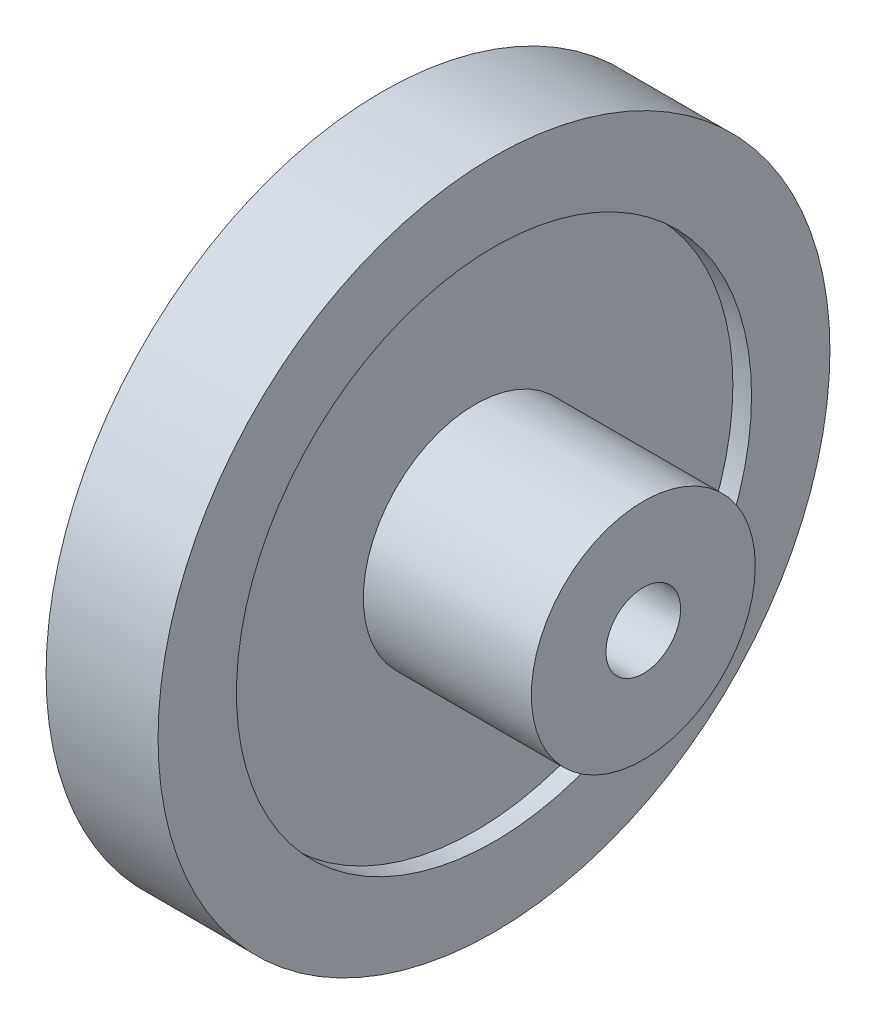
from build123d import *

# Parameters (mm, degrees)
ESQUISSE2_R             = 1
BOSS_EXTRU_1_DEPTH      = 3
ESQUISSE3_R             = 6.9
ENL_V_MAT_EXTRU_1_DEPTH = 0.5
ESQUISSE4_R             = 1
BOSS_EXTRU_2_DEPTH      = 4.5
BOSS_EXTRU_5_START      = -3
ESQUISSE7_R             = 9
ESQUISSE7_R_2           = 6.9
BOSS_EXTRU_5_DEPTH      = 3
BOSS_EXTRU_6_START      = -4.5
ESQUISSE8_R             = 3
ESQUISSE8_R_2           = 1
BOSS_EXTRU_6_DEPTH      = 4.5


with BuildPart() as part:
    # Esquisse2 → Boss.-Extru.1 (new body)
    with BuildSketch(Plane(origin=(0, 0, 0), x_dir=(0, 0, -1), z_dir=(1, 0, 0))):
        with BuildLine():
            ThreePointArc((8.992678526, 0.362950305), (8.983203595, 0.549593642), (8.969855294, 0.736000007))
            add(Edge.make_bspline(
                [(7.928017131, 0.973718567), (7.968735547, 0.978720051), (8.14599471, 0.972060465), (8.43210917, 0.923262044), (8.735368899, 0.829543111), (8.90576586, 0.762906571), (8.969855294, 0.736000007)],
                knots=[0, 0, 0, 0, 0.124841327, 0.52877899, 0.867841808, 1.076016146, 1.076016146, 1.076016146, 1.076016146], degree=3))
            ThreePointArc((7.928017131, 0.973718567), (7.845145349, 0.995861242), (7.801971612, 1.069983161))
            ThreePointArc((7.801971612, 1.069983161), (7.782401197, 1.204099918), (7.760525474, 1.337859996))
            ThreePointArc((7.760525474, 1.337859996), (7.7791127, 1.421320515), (7.851006147, 1.467607399))
            add(Edge.make_bspline(
                [(7.851006147, 1.467607399), (7.891911369, 1.47525391), (8.058869705, 1.535171146), (8.316858832, 1.668153777), (8.577616241, 1.849137964), (8.719907754, 1.964153953), (8.772869142, 2.009170729)],
                knots=[0, 0, 0, 0, 0.124841327, 0.52877899, 0.867841808, 1.076016146, 1.076016146, 1.076016146, 1.076016146], degree=3))
            ThreePointArc((8.772869142, 2.009170729), (8.729259916, 2.190895095), (8.681886815, 2.371674793))
            add(Edge.make_bspline(
                [(7.614107256, 2.413908484), (7.653213344, 2.426306797), (7.828678029, 2.452331888), (8.118887532, 2.456937748), (8.434204497, 2.420538386), (8.613944558, 2.38634682), (8.681886815, 2.371674793)],
                knots=[0, 0, 0, 0, 0.124841327, 0.52877899, 0.867841808, 1.076016146, 1.076016146, 1.076016146, 1.076016146], degree=3))
            ThreePointArc((7.614107256, 2.413908484), (7.528577818, 2.420446487), (7.472519329, 2.485373186))
            ThreePointArc((7.472519329, 2.485373186), (7.428638248, 2.613610296), (7.382556651, 2.741073201))
            ThreePointArc((7.382556651, 2.741073201), (7.385491564, 2.82652804), (7.447655696, 2.885237188))
            add(Edge.make_bspline(
                [(7.447655696, 2.885237188), (7.486459386, 2.900269817), (7.639565176, 2.989845363), (7.868726054, 3.167969089), (8.091787815, 3.393785724), (8.210522412, 3.532989345), (8.254310221, 3.586971254)],
                knots=[0, 0, 0, 0, 0.124841327, 0.52877899, 0.867841808, 1.076016146, 1.076016146, 1.076016146, 1.076016146], degree=3))
            ThreePointArc((8.254310221, 3.586971254), (8.17805176, 3.757588243), (8.098267094, 3.926585039))
            add(Edge.make_bspline(
                [(7.040908091, 3.771895641), (7.077070139, 3.791268575), (7.244765106, 3.849092091), (7.529186917, 3.906945383), (7.845823377, 3.92910513), (8.028785705, 3.928522889), (8.098267094, 3.926585039)],
                knots=[0, 0, 0, 0, 0.124841327, 0.52877899, 0.867841808, 1.076016146, 1.076016146, 1.076016146, 1.076016146], degree=3))
            ThreePointArc((7.040908091, 3.771895641), (6.955633599, 3.76260633), (6.888599363, 3.816126808))
            ThreePointArc((6.888599363, 3.816126808), (6.821901934, 3.93411731), (6.753183716, 4.050942446))
            ThreePointArc((6.753183716, 4.050942446), (6.740366371, 4.135481543), (6.790684263, 4.204613685))
            add(Edge.make_bspline(
                [(6.790684263, 4.204613685), (6.826065008, 4.226520515), (6.960104418, 4.342703981), (7.152633247, 4.559903013), (7.33040326, 4.822862182), (7.421537577, 4.981513022), (7.454660665, 5.042621775)],
                knots=[0, 0, 0, 0, 0.124841327, 0.52877899, 0.867841808, 1.076016146, 1.076016146, 1.076016146, 1.076016146], degree=3))
            ThreePointArc((7.454660665, 5.042621775), (7.34834986, 5.19632123), (7.2388706, 5.34778014))
            add(Edge.make_bspline(
                [(6.227939246, 5.001435417), (6.259925799, 5.027123248), (6.414140397, 5.114776078), (6.683088872, 5.223906679), (6.990262151, 5.303870911), (7.170216185, 5.336917824), (7.2388706, 5.34778014)],
                knots=[0, 0, 0, 0, 0.124841327, 0.52877899, 0.867841808, 1.076016146, 1.076016146, 1.076016146, 1.076016146], degree=3))
            ThreePointArc((6.227939246, 5.001435417), (6.14582362, 4.976635127), (6.070096408, 5.016926809))
            ThreePointArc((6.070096408, 5.016926809), (5.982853931, 5.120652678), (5.893839209, 5.222861704))
            ThreePointArc((5.893839209, 5.222861704), (5.865706085, 5.303606182), (5.902464222, 5.380807106))
            add(Edge.make_bspline(
                [(5.902464222, 5.380807106), (5.933217173, 5.408842125), (6.043625651, 5.547677024), (6.192966094, 5.79655491), (6.319390614, 6.087701853), (6.379821181, 6.260397247), (6.401151581, 6.32655186)],
                knots=[0, 0, 0, 0, 0.124841327, 0.52877899, 0.867841808, 1.076016146, 1.076016146, 1.076016146, 1.076016146], degree=3))
            ThreePointArc((6.401151581, 6.32655186), (6.268408719, 6.45809973), (6.13296305, 6.586863003))
            add(Edge.make_bspline(
                [(5.202885399, 6.060657308), (5.229607193, 6.091785269), (5.36508983, 6.206282501), (5.60940625, 6.362974098), (5.896655932, 6.498019729), (6.067473552, 6.563570423), (6.13296305, 6.586863003)],
                knots=[0, 0, 0, 0, 0.124841327, 0.52877899, 0.867841808, 1.076016146, 1.076016146, 1.076016146, 1.076016146], degree=3))
            ThreePointArc((5.202885399, 6.060657308), (5.126724989, 6.021190583), (5.044883599, 6.046881384))
            ThreePointArc((5.044883599, 6.046881384), (4.940067013, 6.13281036), (4.833787077, 6.216922671))
            ThreePointArc((4.833787077, 6.216922671), (4.791296214, 6.291122873), (4.813242841, 6.373763594))
            add(Edge.make_bspline(
                [(4.813242841, 6.373763594), (4.838320743, 6.406972104), (4.921338461, 6.563730579), (5.022404908, 6.835812081), (5.0931787, 7.145232139), (5.120847626, 7.326091153), (5.129658958, 7.395038808)],
                knots=[0, 0, 0, 0, 0.124841327, 0.52877899, 0.867841808, 1.076016146, 1.076016146, 1.076016146, 1.076016146], degree=3))
            ThreePointArc((5.129658958, 7.395038808), (4.975004437, 7.49995539), (4.818204799, 7.601638147))
            add(Edge.make_bspline(
                [(4.00065353, 6.913490784), (4.021200587, 6.948998848), (4.133337563, 7.086441417), (4.344702027, 7.285358066), (4.602246167, 7.470886279), (4.758110384, 7.566708503), (4.818204799, 7.601638147)],
                knots=[0, 0, 0, 0, 0.124841327, 0.52877899, 0.867841808, 1.076016146, 1.076016146, 1.076016146, 1.076016146], degree=3))
            ThreePointArc((4.00065353, 6.913490784), (3.933041887, 6.860701616), (3.84787333, 6.870916666))
            ThreePointArc((3.84787333, 6.870916666), (3.729052038, 6.936122541), (3.609126123, 6.999273793))
            ThreePointArc((3.609126123, 6.999273793), (3.553724497, 7.06440292), (3.560112248, 7.149669208))
            add(Edge.make_bspline(
                [(3.560112248, 7.149669208), (3.578661103, 7.186920332), (3.631460993, 7.356264162), (3.680811746, 7.64228387), (3.693524693, 7.959440113), (3.687489747, 8.142303811), (3.683481951, 8.21169658)],
                knots=[0, 0, 0, 0, 0.124841327, 0.52877899, 0.867841808, 1.076016146, 1.076016146, 1.076016146, 1.076016146], degree=3))
            ThreePointArc((3.683481951, 8.21169658), (3.512182346, 8.286409063), (3.339368362, 8.35754862))
            add(Edge.make_bspline(
                [(2.662184203, 7.530893622), (2.675856818, 7.569572607), (2.760829443, 7.72528007), (2.932044187, 7.959647903), (3.151112429, 8.189340757), (3.286715474, 8.3121714), (3.339368362, 8.35754862)],
                knots=[0, 0, 0, 0, 0.124841327, 0.52877899, 0.867841808, 1.076016146, 1.076016146, 1.076016146, 1.076016146], degree=3))
            ThreePointArc((2.662184203, 7.530893622), (2.605423761, 7.466579684), (2.51982835, 7.460971122))
            ThreePointArc((2.51982835, 7.460971122), (2.391048668, 7.503233388), (2.261560708, 7.543273041))
            ThreePointArc((2.261560708, 7.543273041), (2.195134954, 7.597113198), (2.185746302, 7.682101412))
            add(Edge.make_bspline(
                [(2.185746302, 7.682101412), (2.197134452, 7.722126608), (2.217918476, 7.898288992), (2.213872956, 8.188506848), (2.168092134, 8.502598901), (2.128558827, 8.681240079), (2.111868384, 8.748714873)],
                knots=[0, 0, 0, 0, 0.124841327, 0.52877899, 0.867841808, 1.076016146, 1.076016146, 1.076016146, 1.076016146], degree=3))
            ThreePointArc((2.111868384, 8.748714873), (1.929757098, 8.790679015), (1.74681374, 8.8288528))
            add(Edge.make_bspline(
                [(1.233057386, 7.891840911), (1.239389954, 7.932373648), (1.294304588, 8.101043575), (1.419539098, 8.362881478), (1.592671336, 8.628917058), (1.70339541, 8.77457327), (1.74681374, 8.8288528)],
                knots=[0, 0, 0, 0, 0.124841327, 0.52877899, 0.867841808, 1.076016146, 1.076016146, 1.076016146, 1.076016146], degree=3))
            ThreePointArc((1.233057386, 7.891840911), (1.189081054, 7.818192336), (1.105973638, 7.796951155))
            ThreePointArc((1.105973638, 7.796951155), (0.971621004, 7.81483062), (0.836980555, 7.830395172))
            ThreePointArc((0.836980555, 7.830395172), (0.761792723, 7.871112898), (0.736947387, 7.952928866))
            add(Edge.make_bspline(
                [(0.736947387, 7.952928866), (0.740787022, 7.994365125), (0.728847405, 8.171347063), (0.671543377, 8.455880046), (0.568827797, 8.756211882), (0.49714239, 8.924547128), (0.468337672, 8.987806174)],
                knots=[0, 0, 0, 0, 0.124841327, 0.52877899, 0.867841808, 1.076016146, 1.076016146, 1.076016146, 1.076016146], degree=3))
            ThreePointArc((0.468337672, 8.987806174), (0.281616286, 8.995592936), (0.094773472, 8.999500986))
            add(Edge.make_bspline(
                [(-0.238059721, 7.984041022), (-0.239282848, 8.02504722), (-0.216296258, 8.200935757), (-0.141306691, 8.481327153), (-0.020006268, 8.774645937), (0.062068259, 8.938167571), (0.094773472, 8.999500986)],
                knots=[0, 0, 0, 0, 0.124841327, 0.52877899, 0.867841808, 1.076016146, 1.076016146, 1.076016146, 1.076016146], degree=3))
            ThreePointArc((-0.238059721, 7.984041022), (-0.267754383, 7.903565825), (-0.34554368, 7.867415368))
            ThreePointArc((-0.34554368, 7.867415368), (-0.480894049, 7.860303169), (-0.616101967, 7.850862587))
            ThreePointArc((-0.616101967, 7.850862587), (-0.697491446, 7.877071289), (-0.736947387, 7.952928866))
            add(Edge.make_bspline(
                [(-0.736947387, 7.952928866), (-0.740787022, 7.994365125), (-0.78504369, 8.166139711), (-0.893654807, 8.435298391), (-1.049807289, 8.711642568), (-1.151203635, 8.863939428), (-1.191141718, 8.920828516)],
                knots=[0, 0, 0, 0, 0.124841327, 0.52877899, 0.867841808, 1.076016146, 1.076016146, 1.076016146, 1.076016146], degree=3))
            ThreePointArc((-1.191141718, 8.920828516), (-1.376114631, 8.894172728), (-1.560494193, 8.863681959))
            add(Edge.make_bspline(
                [(-1.70106999, 7.804354193), (-1.70980716, 7.844437433), (-1.719531394, 8.021554909), (-1.697340451, 8.310951405), (-1.632002584, 8.621564774), (-1.581372552, 8.797383295), (-1.560494193, 8.863681959)],
                knots=[0, 0, 0, 0, 0.124841327, 0.52877899, 0.867841808, 1.076016146, 1.076016146, 1.076016146, 1.076016146], degree=3))
            ThreePointArc((-1.70106999, 7.804354193), (-1.715471765, 7.719792859), (-1.785293922, 7.669964186))
            ThreePointArc((-1.785293922, 7.669964186), (-1.917032831, 7.638102521), (-2.048203875, 7.603978293))
            ThreePointArc((-2.048203875, 7.603978293), (-2.13302338, 7.614785465), (-2.185746302, 7.682101412))
            add(Edge.make_bspline(
                [(-2.185746302, 7.682101412), (-2.197134452, 7.722126608), (-2.272201064, 7.882844264), (-2.428420647, 8.127462766), (-2.632692446, 8.370408715), (-2.760346802, 8.501480902), (-2.810058205, 8.550062742)],
                knots=[0, 0, 0, 0, 0.124841327, 0.52877899, 0.867841808, 1.076016146, 1.076016146, 1.076016146, 1.076016146], degree=3))
            ThreePointArc((-2.810058205, 8.550062742), (-2.986983615, 8.489872136), (-3.1626211, 8.426020875))
            add(Edge.make_bspline(
                [(-3.106152361, 7.358899441), (-3.12210604, 7.396694737), (-3.164209951, 7.569009628), (-3.195573318, 7.857556174), (-3.188423008, 8.174886562), (-3.170961618, 8.357014683), (-3.1626211, 8.426020875)],
                knots=[0, 0, 0, 0, 0.124841327, 0.52877899, 0.867841808, 1.076016146, 1.076016146, 1.076016146, 1.076016146], degree=3))
            ThreePointArc((-3.106152361, 7.358899441), (-3.104770813, 7.273131606), (-3.164248122, 7.211321573))
            ThreePointArc((-3.164248122, 7.211321573), (-3.287889359, 7.155795453), (-3.410556657, 7.098149639))
            ThreePointArc((-3.410556657, 7.098149639), (-3.49591776, 7.093187254), (-3.560112248, 7.149669208))
            add(Edge.make_bspline(
                [(-3.560112248, 7.149669208), (-3.578661103, 7.186920332), (-3.681981355, 7.331108011), (-3.880489536, 7.542856145), (-4.125924419, 7.744130633), (-4.275489668, 7.84951464), (-4.33328153, 7.888134836)],
                knots=[0, 0, 0, 0, 0.124841327, 0.52877899, 0.867841808, 1.076016146, 1.076016146, 1.076016146, 1.076016146], degree=3))
            ThreePointArc((-4.33328153, 7.888134836), (-4.496134454, 7.79645913), (-4.657048739, 7.701421755))
            add(Edge.make_bspline(
                [(-4.405458438, 6.662846196), (-4.428085343, 6.697066474), (-4.501135134, 6.858710803), (-4.584984768, 7.136581292), (-4.636265512, 7.449822393), (-4.652567389, 7.632057959), (-4.657048739, 7.701421755)],
                knots=[0, 0, 0, 0, 0.124841327, 0.52877899, 0.867841808, 1.076016146, 1.076016146, 1.076016146, 1.076016146], degree=3))
            ThreePointArc((-4.405458438, 6.662846196), (-4.388340616, 6.578792579), (-4.435447646, 6.507106053))
            ThreePointArc((-4.435447646, 6.507106053), (-4.546780759, 6.429806352), (-4.656767022, 6.350602011))
            ThreePointArc((-4.656767022, 6.350602011), (-4.739762855, 6.330039059), (-4.813242841, 6.373763594))
            add(Edge.make_bspline(
                [(-4.813242841, 6.373763594), (-4.838320743, 6.406972104), (-4.966376188, 6.529719667), (-5.200413007, 6.701386604), (-5.478652985, 6.85413547), (-5.645035862, 6.930242572), (-5.70894015, 6.957585958)],
                knots=[0, 0, 0, 0, 0.124841327, 0.52877899, 0.867841808, 1.076016146, 1.076016146, 1.076016146, 1.076016146], degree=3))
            ThreePointArc((-5.70894015, 6.957585958), (-5.852174827, 6.83754706), (-5.992886168, 6.714559954))
            add(Edge.make_bspline(
                [(-5.554741912, 5.739897714), (-5.58327151, 5.769377644), (-5.684779557, 5.914846807), (-5.81826006, 6.172578694), (-5.926225553, 6.471063457), (-5.975735558, 6.647200654), (-5.992886168, 6.714559954)],
                knots=[0, 0, 0, 0, 0.124841327, 0.52877899, 0.867841808, 1.076016146, 1.076016146, 1.076016146, 1.076016146], degree=3))
            ThreePointArc((-5.554741912, 5.739897714), (-5.522470742, 5.660420661), (-5.555603321, 5.58129884))
            ThreePointArc((-5.555603321, 5.58129884), (-5.650836993, 5.484857908), (-5.744396771, 5.386792249))
            ThreePointArc((-5.744396771, 5.386792249), (-5.82220101, 5.351328976), (-5.902464222, 5.380807106))
            add(Edge.make_bspline(
                [(-5.902464222, 5.380807106), (-5.933217173, 5.408842125), (-6.081647036, 5.505969552), (-6.34324265, 5.63170938), (-6.644812595, 5.730730945), (-6.82234713, 5.774969405), (-6.89018766, 5.790104836)],
                knots=[0, 0, 0, 0, 0.124841327, 0.52877899, 0.867841808, 1.076016146, 1.076016146, 1.076016146, 1.076016146], degree=3))
            ThreePointArc((-6.89018766, 5.790104836), (-7.008926405, 5.645790525), (-7.124643046, 5.499041868))
            add(Edge.make_bspline(
                [(-6.514865313, 4.6214839), (-6.548326063, 4.645219578), (-6.674835631, 4.769559798), (-6.853401485, 4.998376331), (-7.014375092, 5.271940217), (-7.095407219, 5.435980904), (-7.124643046, 5.499041868)],
                knots=[0, 0, 0, 0, 0.124841327, 0.52877899, 0.867841808, 1.076016146, 1.076016146, 1.076016146, 1.076016146], degree=3))
            ThreePointArc((-6.514865313, 4.6214839), (-6.46853975, 4.549289907), (-6.486569587, 4.46542719))
            ThreePointArc((-6.486569587, 4.46542719), (-6.562460751, 4.353129207), (-6.636407979, 4.239541737))
            ThreePointArc((-6.636407979, 4.239541737), (-6.706371093, 4.190385802), (-6.790684263, 4.204613685))
            add(Edge.make_bspline(
                [(-6.790684263, 4.204613685), (-6.826065008, 4.226520515), (-6.989814688, 4.294720246), (-7.270060773, 4.370251048), (-7.584691081, 4.41217325), (-7.767331549, 4.423036581), (-7.836798093, 4.425448638)],
                knots=[0, 0, 0, 0, 0.124841327, 0.52877899, 0.867841808, 1.076016146, 1.076016146, 1.076016146, 1.076016146], degree=3))
            ThreePointArc((-7.836798093, 4.425448638), (-7.9269974, 4.261773366), (-8.013778751, 4.096260505))
            add(Edge.make_bspline(
                [(-7.253132789, 3.345690994), (-7.290385226, 3.362874131), (-7.437588183, 3.46185115), (-7.655158542, 3.653960257), (-7.863658499, 3.893287376), (-7.973453297, 4.039645344), (-8.013778751, 4.096260505)],
                knots=[0, 0, 0, 0, 0.124841327, 0.52877899, 0.867841808, 1.076016146, 1.076016146, 1.076016146, 1.076016146], degree=3))
            ThreePointArc((-7.253132789, 3.345690994), (-7.194330395, 3.283238541), (-7.196643507, 3.197490772))
            ThreePointArc((-7.196643507, 3.197490772), (-7.250607779, 3.073159911), (-7.302424271, 2.947918717))
            ThreePointArc((-7.302424271, 2.947918717), (-7.362163751, 2.886744066), (-7.447655696, 2.885237188))
            add(Edge.make_bspline(
                [(-7.447655696, 2.885237188), (-7.486459386, 2.900269817), (-7.659952585, 2.937219394), (-7.949305695, 2.959969057), (-8.266282009, 2.943364287), (-8.447808808, 2.920482551), (-8.516535767, 2.910089094)],
                knots=[0, 0, 0, 0, 0.124841327, 0.52877899, 0.867841808, 1.076016146, 1.076016146, 1.076016146, 1.076016146], degree=3))
            ThreePointArc((-8.516535767, 2.910089094), (-8.575124006, 2.732626625), (-8.630014832, 2.553985905))
            add(Edge.make_bspline(
                [(-7.744403527, 1.955964595), (-7.784179063, 1.966010038), (-7.94706259, 2.036253313), (-8.196228356, 2.185112949), (-8.445154448, 2.382053302), (-8.579972987, 2.505744507), (-8.630014832, 2.553985905)],
                knots=[0, 0, 0, 0, 0.124841327, 0.52877899, 0.867841808, 1.076016146, 1.076016146, 1.076016146, 1.076016146], degree=3))
            ThreePointArc((-7.744403527, 1.955964595), (-7.675126748, 1.905380425), (-7.661644363, 1.820667641))
            ThreePointArc((-7.661644363, 1.820667641), (-7.691844055, 1.68853784), (-7.719765264, 1.55590786))
            ThreePointArc((-7.719765264, 1.55590786), (-7.767246753, 1.484797724), (-7.851006147, 1.467607399))
            add(Edge.make_bspline(
                [(-7.851006147, 1.467607399), (-7.891911369, 1.47525391), (-8.069239983, 1.479695059), (-8.357846547, 1.448888871), (-8.666374618, 1.374322583), (-8.84060607, 1.318474991), (-8.906253029, 1.295629957)],
                knots=[0, 0, 0, 0, 0.124841327, 0.52877899, 0.867841808, 1.076016146, 1.076016146, 1.076016146, 1.076016146], degree=3))
            ThreePointArc((-8.906253029, 1.295629957), (-8.93123505, 1.110423563), (-8.952366108, 0.924738377))
            add(Edge.make_bspline(
                [(-7.971947891, 0.499630167), (-8.012892019, 0.502195832), (-8.185909312, 0.541313312), (-8.458185443, 0.641854241), (-8.73906079, 0.78970126), (-8.894311987, 0.886513545), (-8.952366108, 0.924738377)],
                knots=[0, 0, 0, 0, 0.124841327, 0.52877899, 0.867841808, 1.076016146, 1.076016146, 1.076016146, 1.076016146], degree=3))
            ThreePointArc((-7.971947891, 0.499630167), (-7.894555864, 0.462636863), (-7.865737109, 0.381843858))
            ThreePointArc((-7.865737109, 0.381843858), (-7.871143807, 0.246414639), (-7.874218909, 0.110912427))
            ThreePointArc((-7.874218909, 0.110912427), (-7.907825483, 0.032288375), (-7.987, 0))
            add(Edge.make_bspline(
                [(-7.987, 0), (-8.028613776, 0), (-8.203739092, -0.028218518), (-8.481770958, -0.111531489), (-8.771344233, -0.241520028), (-8.932347096, -0.328431654), (-8.992678526, -0.362950305)],
                knots=[0, 0, 0, 0, 0.124841327, 0.52877899, 0.867841808, 1.076016146, 1.076016146, 1.076016146, 1.076016146], degree=3))
            ThreePointArc((-8.992678526, -0.362950305), (-8.983203595, -0.549593642), (-8.969855294, -0.736000007))
            add(Edge.make_bspline(
                [(-7.928017131, -0.973718567), (-7.968735547, -0.978720051), (-8.14599471, -0.972060465), (-8.43210917, -0.923262044), (-8.735368899, -0.829543111), (-8.90576586, -0.762906571), (-8.969855294, -0.736000007)],
                knots=[0, 0, 0, 0, 0.124841327, 0.52877899, 0.867841808, 1.076016146, 1.076016146, 1.076016146, 1.076016146], degree=3))
            ThreePointArc((-7.928017131, -0.973718567), (-7.845145349, -0.995861242), (-7.801971612, -1.069983161))
            ThreePointArc((-7.801971612, -1.069983161), (-7.782401197, -1.204099918), (-7.760525474, -1.337859996))
            ThreePointArc((-7.760525474, -1.337859996), (-7.7791127, -1.421320515), (-7.851006147, -1.467607399))
            add(Edge.make_bspline(
                [(-7.851006147, -1.467607399), (-7.891911369, -1.47525391), (-8.058869705, -1.535171146), (-8.316858832, -1.668153777), (-8.577616241, -1.849137964), (-8.719907754, -1.964153953), (-8.772869142, -2.009170729)],
                knots=[0, 0, 0, 0, 0.124841327, 0.52877899, 0.867841808, 1.076016146, 1.076016146, 1.076016146, 1.076016146], degree=3))
            ThreePointArc((-8.772869142, -2.009170729), (-8.729259916, -2.190895095), (-8.681886815, -2.371674793))
            add(Edge.make_bspline(
                [(-7.614107256, -2.413908484), (-7.653213344, -2.426306797), (-7.828678029, -2.452331888), (-8.118887532, -2.456937748), (-8.434204497, -2.420538386), (-8.613944558, -2.38634682), (-8.681886815, -2.371674793)],
                knots=[0, 0, 0, 0, 0.124841327, 0.52877899, 0.867841808, 1.076016146, 1.076016146, 1.076016146, 1.076016146], degree=3))
            ThreePointArc((-7.614107256, -2.413908484), (-7.528577818, -2.420446487), (-7.472519329, -2.485373186))
            ThreePointArc((-7.472519329, -2.485373186), (-7.428638248, -2.613610296), (-7.382556651, -2.741073201))
            ThreePointArc((-7.382556651, -2.741073201), (-7.385491564, -2.82652804), (-7.447655696, -2.885237188))
            add(Edge.make_bspline(
                [(-7.447655696, -2.885237188), (-7.486459386, -2.900269817), (-7.639565176, -2.989845363), (-7.868726054, -3.167969089), (-8.091787815, -3.393785724), (-8.210522412, -3.532989345), (-8.254310221, -3.586971254)],
                knots=[0, 0, 0, 0, 0.124841327, 0.52877899, 0.867841808, 1.076016146, 1.076016146, 1.076016146, 1.076016146], degree=3))
            ThreePointArc((-8.254310221, -3.586971254), (-8.17805176, -3.757588243), (-8.098267094, -3.926585039))
            add(Edge.make_bspline(
                [(-7.040908091, -3.771895641), (-7.077070139, -3.791268575), (-7.244765106, -3.849092091), (-7.529186917, -3.906945383), (-7.845823377, -3.92910513), (-8.028785705, -3.928522889), (-8.098267094, -3.926585039)],
                knots=[0, 0, 0, 0, 0.124841327, 0.52877899, 0.867841808, 1.076016146, 1.076016146, 1.076016146, 1.076016146], degree=3))
            ThreePointArc((-7.040908091, -3.771895641), (-6.955633599, -3.76260633), (-6.888599363, -3.816126808))
            ThreePointArc((-6.888599363, -3.816126808), (-6.821901934, -3.93411731), (-6.753183716, -4.050942446))
            ThreePointArc((-6.753183716, -4.050942446), (-6.740366371, -4.135481543), (-6.790684263, -4.204613685))
            add(Edge.make_bspline(
                [(-6.790684263, -4.204613685), (-6.826065008, -4.226520515), (-6.960104418, -4.342703981), (-7.152633247, -4.559903013), (-7.33040326, -4.822862182), (-7.421537577, -4.981513022), (-7.454660665, -5.042621775)],
                knots=[0, 0, 0, 0, 0.124841327, 0.52877899, 0.867841808, 1.076016146, 1.076016146, 1.076016146, 1.076016146], degree=3))
            ThreePointArc((-7.454660665, -5.042621775), (-7.34834986, -5.19632123), (-7.2388706, -5.34778014))
            add(Edge.make_bspline(
                [(-6.227939246, -5.001435417), (-6.259925799, -5.027123248), (-6.414140397, -5.114776078), (-6.683088872, -5.223906679), (-6.990262151, -5.303870911), (-7.170216185, -5.336917824), (-7.2388706, -5.34778014)],
                knots=[0, 0, 0, 0, 0.124841327, 0.52877899, 0.867841808, 1.076016146, 1.076016146, 1.076016146, 1.076016146], degree=3))
            ThreePointArc((-6.227939246, -5.001435417), (-6.14582362, -4.976635127), (-6.070096408, -5.016926809))
            ThreePointArc((-6.070096408, -5.016926809), (-5.982853931, -5.120652678), (-5.893839209, -5.222861704))
            ThreePointArc((-5.893839209, -5.222861704), (-5.865706085, -5.303606182), (-5.902464222, -5.380807106))
            add(Edge.make_bspline(
                [(-5.902464222, -5.380807106), (-5.933217173, -5.408842125), (-6.043625651, -5.547677024), (-6.192966094, -5.79655491), (-6.319390614, -6.087701853), (-6.379821181, -6.260397247), (-6.401151581, -6.32655186)],
                knots=[0, 0, 0, 0, 0.124841327, 0.52877899, 0.867841808, 1.076016146, 1.076016146, 1.076016146, 1.076016146], degree=3))
            ThreePointArc((-6.401151581, -6.32655186), (-6.268408719, -6.45809973), (-6.13296305, -6.586863003))
            add(Edge.make_bspline(
                [(-5.202885399, -6.060657308), (-5.229607193, -6.091785269), (-5.36508983, -6.206282501), (-5.60940625, -6.362974098), (-5.896655932, -6.498019729), (-6.067473552, -6.563570423), (-6.13296305, -6.586863003)],
                knots=[0, 0, 0, 0, 0.124841327, 0.52877899, 0.867841808, 1.076016146, 1.076016146, 1.076016146, 1.076016146], degree=3))
            ThreePointArc((-5.202885399, -6.060657308), (-5.126724989, -6.021190583), (-5.044883599, -6.046881384))
            ThreePointArc((-5.044883599, -6.046881384), (-4.940067013, -6.13281036), (-4.833787077, -6.216922671))
            ThreePointArc((-4.833787077, -6.216922671), (-4.791296214, -6.291122873), (-4.813242841, -6.373763594))
            add(Edge.make_bspline(
                [(-4.813242841, -6.373763594), (-4.838320743, -6.406972104), (-4.921338461, -6.563730579), (-5.022404908, -6.835812081), (-5.0931787, -7.145232139), (-5.120847626, -7.326091153), (-5.129658958, -7.395038808)],
                knots=[0, 0, 0, 0, 0.124841327, 0.52877899, 0.867841808, 1.076016146, 1.076016146, 1.076016146, 1.076016146], degree=3))
            ThreePointArc((-5.129658958, -7.395038808), (-4.975004437, -7.49995539), (-4.818204799, -7.601638147))
            add(Edge.make_bspline(
                [(-4.00065353, -6.913490784), (-4.021200587, -6.948998848), (-4.133337563, -7.086441417), (-4.344702027, -7.285358066), (-4.602246167, -7.470886279), (-4.758110384, -7.566708503), (-4.818204799, -7.601638147)],
                knots=[0, 0, 0, 0, 0.124841327, 0.52877899, 0.867841808, 1.076016146, 1.076016146, 1.076016146, 1.076016146], degree=3))
            ThreePointArc((-4.00065353, -6.913490784), (-3.933041887, -6.860701616), (-3.84787333, -6.870916666))
            ThreePointArc((-3.84787333, -6.870916666), (-3.729052038, -6.936122541), (-3.609126123, -6.999273793))
            ThreePointArc((-3.609126123, -6.999273793), (-3.553724497, -7.06440292), (-3.560112248, -7.149669208))
            add(Edge.make_bspline(
                [(-3.560112248, -7.149669208), (-3.578661103, -7.186920332), (-3.631460993, -7.356264162), (-3.680811746, -7.64228387), (-3.693524693, -7.959440113), (-3.687489747, -8.142303811), (-3.683481951, -8.21169658)],
                knots=[0, 0, 0, 0, 0.124841327, 0.52877899, 0.867841808, 1.076016146, 1.076016146, 1.076016146, 1.076016146], degree=3))
            ThreePointArc((-3.683481951, -8.21169658), (-3.512182346, -8.286409063), (-3.339368362, -8.35754862))
            add(Edge.make_bspline(
                [(-2.662184203, -7.530893622), (-2.675856818, -7.569572607), (-2.760829443, -7.72528007), (-2.932044187, -7.959647903), (-3.151112429, -8.189340757), (-3.286715474, -8.3121714), (-3.339368362, -8.35754862)],
                knots=[0, 0, 0, 0, 0.124841327, 0.52877899, 0.867841808, 1.076016146, 1.076016146, 1.076016146, 1.076016146], degree=3))
            ThreePointArc((-2.662184203, -7.530893622), (-2.605423761, -7.466579684), (-2.51982835, -7.460971122))
            ThreePointArc((-2.51982835, -7.460971122), (-2.391048668, -7.503233388), (-2.261560708, -7.543273041))
            ThreePointArc((-2.261560708, -7.543273041), (-2.195134954, -7.597113198), (-2.185746302, -7.682101412))
            add(Edge.make_bspline(
                [(-2.185746302, -7.682101412), (-2.197134452, -7.722126608), (-2.217918476, -7.898288992), (-2.213872956, -8.188506848), (-2.168092134, -8.502598901), (-2.128558827, -8.681240079), (-2.111868384, -8.748714873)],
                knots=[0, 0, 0, 0, 0.124841327, 0.52877899, 0.867841808, 1.076016146, 1.076016146, 1.076016146, 1.076016146], degree=3))
            ThreePointArc((-2.111868384, -8.748714873), (-1.929757098, -8.790679015), (-1.74681374, -8.8288528))
            add(Edge.make_bspline(
                [(-1.233057386, -7.891840911), (-1.239389954, -7.932373648), (-1.294304588, -8.101043575), (-1.419539098, -8.362881478), (-1.592671336, -8.628917058), (-1.70339541, -8.77457327), (-1.74681374, -8.8288528)],
                knots=[0, 0, 0, 0, 0.124841327, 0.52877899, 0.867841808, 1.076016146, 1.076016146, 1.076016146, 1.076016146], degree=3))
            ThreePointArc((-1.233057386, -7.891840911), (-1.189081054, -7.818192336), (-1.105973638, -7.796951155))
            ThreePointArc((-1.105973638, -7.796951155), (-0.971621004, -7.81483062), (-0.836980555, -7.830395172))
            ThreePointArc((-0.836980555, -7.830395172), (-0.761792723, -7.871112898), (-0.736947387, -7.952928866))
            add(Edge.make_bspline(
                [(-0.736947387, -7.952928866), (-0.740787022, -7.994365125), (-0.728847405, -8.171347063), (-0.671543377, -8.455880046), (-0.568827797, -8.756211882), (-0.49714239, -8.924547128), (-0.468337672, -8.987806174)],
                knots=[0, 0, 0, 0, 0.124841327, 0.52877899, 0.867841808, 1.076016146, 1.076016146, 1.076016146, 1.076016146], degree=3))
            ThreePointArc((-0.468337672, -8.987806174), (-0.281616286, -8.995592936), (-0.094773472, -8.999500986))
            add(Edge.make_bspline(
                [(0.238059721, -7.984041022), (0.239282848, -8.02504722), (0.216296258, -8.200935757), (0.141306691, -8.481327153), (0.020006268, -8.774645937), (-0.062068259, -8.938167571), (-0.094773472, -8.999500986)],
                knots=[0, 0, 0, 0, 0.124841327, 0.52877899, 0.867841808, 1.076016146, 1.076016146, 1.076016146, 1.076016146], degree=3))
            ThreePointArc((0.238059721, -7.984041022), (0.267754383, -7.903565825), (0.34554368, -7.867415368))
            ThreePointArc((0.34554368, -7.867415368), (0.480894049, -7.860303169), (0.616101967, -7.850862587))
            ThreePointArc((0.616101967, -7.850862587), (0.697491446, -7.877071289), (0.736947387, -7.952928866))
            add(Edge.make_bspline(
                [(0.736947387, -7.952928866), (0.740787022, -7.994365125), (0.78504369, -8.166139711), (0.893654807, -8.435298391), (1.049807289, -8.711642568), (1.151203635, -8.863939428), (1.191141718, -8.920828516)],
                knots=[0, 0, 0, 0, 0.124841327, 0.52877899, 0.867841808, 1.076016146, 1.076016146, 1.076016146, 1.076016146], degree=3))
            ThreePointArc((1.191141718, -8.920828516), (1.376114631, -8.894172728), (1.560494193, -8.863681959))
            add(Edge.make_bspline(
                [(1.70106999, -7.804354193), (1.70980716, -7.844437433), (1.719531394, -8.021554909), (1.697340451, -8.310951405), (1.632002584, -8.621564774), (1.581372552, -8.797383295), (1.560494193, -8.863681959)],
                knots=[0, 0, 0, 0, 0.124841327, 0.52877899, 0.867841808, 1.076016146, 1.076016146, 1.076016146, 1.076016146], degree=3))
            ThreePointArc((1.70106999, -7.804354193), (1.715471765, -7.719792859), (1.785293922, -7.669964186))
            ThreePointArc((1.785293922, -7.669964186), (1.917032831, -7.638102521), (2.048203875, -7.603978293))
            ThreePointArc((2.048203875, -7.603978293), (2.13302338, -7.614785465), (2.185746302, -7.682101412))
            add(Edge.make_bspline(
                [(2.185746302, -7.682101412), (2.197134452, -7.722126608), (2.272201064, -7.882844264), (2.428420647, -8.127462766), (2.632692446, -8.370408715), (2.760346802, -8.501480902), (2.810058205, -8.550062742)],
                knots=[0, 0, 0, 0, 0.124841327, 0.52877899, 0.867841808, 1.076016146, 1.076016146, 1.076016146, 1.076016146], degree=3))
            ThreePointArc((2.810058205, -8.550062742), (2.986983615, -8.489872136), (3.1626211, -8.426020875))
            add(Edge.make_bspline(
                [(3.106152361, -7.358899441), (3.12210604, -7.396694737), (3.164209951, -7.569009628), (3.195573318, -7.857556174), (3.188423008, -8.174886562), (3.170961618, -8.357014683), (3.1626211, -8.426020875)],
                knots=[0, 0, 0, 0, 0.124841327, 0.52877899, 0.867841808, 1.076016146, 1.076016146, 1.076016146, 1.076016146], degree=3))
            ThreePointArc((3.106152361, -7.358899441), (3.104770813, -7.273131606), (3.164248122, -7.211321573))
            ThreePointArc((3.164248122, -7.211321573), (3.287889359, -7.155795453), (3.410556657, -7.098149639))
            ThreePointArc((3.410556657, -7.098149639), (3.49591776, -7.093187254), (3.560112248, -7.149669208))
            add(Edge.make_bspline(
                [(3.560112248, -7.149669208), (3.578661103, -7.186920332), (3.681981355, -7.331108011), (3.880489536, -7.542856145), (4.125924419, -7.744130633), (4.275489668, -7.84951464), (4.33328153, -7.888134836)],
                knots=[0, 0, 0, 0, 0.124841327, 0.52877899, 0.867841808, 1.076016146, 1.076016146, 1.076016146, 1.076016146], degree=3))
            ThreePointArc((4.33328153, -7.888134836), (4.496134454, -7.79645913), (4.657048739, -7.701421755))
            add(Edge.make_bspline(
                [(4.405458438, -6.662846196), (4.428085343, -6.697066474), (4.501135134, -6.858710803), (4.584984768, -7.136581292), (4.636265512, -7.449822393), (4.652567389, -7.632057959), (4.657048739, -7.701421755)],
                knots=[0, 0, 0, 0, 0.124841327, 0.52877899, 0.867841808, 1.076016146, 1.076016146, 1.076016146, 1.076016146], degree=3))
            ThreePointArc((4.405458438, -6.662846196), (4.388340616, -6.578792579), (4.435447646, -6.507106053))
            ThreePointArc((4.435447646, -6.507106053), (4.546780759, -6.429806352), (4.656767022, -6.350602011))
            ThreePointArc((4.656767022, -6.350602011), (4.739762855, -6.330039059), (4.813242841, -6.373763594))
            add(Edge.make_bspline(
                [(4.813242841, -6.373763594), (4.838320743, -6.406972104), (4.966376188, -6.529719667), (5.200413007, -6.701386604), (5.478652985, -6.85413547), (5.645035862, -6.930242572), (5.70894015, -6.957585958)],
                knots=[0, 0, 0, 0, 0.124841327, 0.52877899, 0.867841808, 1.076016146, 1.076016146, 1.076016146, 1.076016146], degree=3))
            ThreePointArc((5.70894015, -6.957585958), (5.852174827, -6.83754706), (5.992886168, -6.714559954))
            add(Edge.make_bspline(
                [(5.554741912, -5.739897714), (5.58327151, -5.769377644), (5.684779557, -5.914846807), (5.81826006, -6.172578694), (5.926225553, -6.471063457), (5.975735558, -6.647200654), (5.992886168, -6.714559954)],
                knots=[0, 0, 0, 0, 0.124841327, 0.52877899, 0.867841808, 1.076016146, 1.076016146, 1.076016146, 1.076016146], degree=3))
            ThreePointArc((5.554741912, -5.739897714), (5.522470742, -5.660420661), (5.555603321, -5.58129884))
            ThreePointArc((5.555603321, -5.58129884), (5.650836993, -5.484857908), (5.744396771, -5.386792249))
            ThreePointArc((5.744396771, -5.386792249), (5.82220101, -5.351328976), (5.902464222, -5.380807106))
            add(Edge.make_bspline(
                [(5.902464222, -5.380807106), (5.933217173, -5.408842125), (6.081647036, -5.505969552), (6.34324265, -5.63170938), (6.644812595, -5.730730945), (6.82234713, -5.774969405), (6.89018766, -5.790104836)],
                knots=[0, 0, 0, 0, 0.124841327, 0.52877899, 0.867841808, 1.076016146, 1.076016146, 1.076016146, 1.076016146], degree=3))
            ThreePointArc((6.89018766, -5.790104836), (7.008926405, -5.645790525), (7.124643046, -5.499041868))
            add(Edge.make_bspline(
                [(6.514865313, -4.6214839), (6.548326063, -4.645219578), (6.674835631, -4.769559798), (6.853401485, -4.998376331), (7.014375092, -5.271940217), (7.095407219, -5.435980904), (7.124643046, -5.499041868)],
                knots=[0, 0, 0, 0, 0.124841327, 0.52877899, 0.867841808, 1.076016146, 1.076016146, 1.076016146, 1.076016146], degree=3))
            ThreePointArc((6.514865313, -4.6214839), (6.46853975, -4.549289907), (6.486569587, -4.46542719))
            ThreePointArc((6.486569587, -4.46542719), (6.562460751, -4.353129207), (6.636407979, -4.239541737))
            ThreePointArc((6.636407979, -4.239541737), (6.706371093, -4.190385802), (6.790684263, -4.204613685))
            add(Edge.make_bspline(
                [(6.790684263, -4.204613685), (6.826065008, -4.226520515), (6.989814688, -4.294720246), (7.270060773, -4.370251048), (7.584691081, -4.41217325), (7.767331549, -4.423036581), (7.836798093, -4.425448638)],
                knots=[0, 0, 0, 0, 0.124841327, 0.52877899, 0.867841808, 1.076016146, 1.076016146, 1.076016146, 1.076016146], degree=3))
            ThreePointArc((7.836798093, -4.425448638), (7.9269974, -4.261773366), (8.013778751, -4.096260505))
            add(Edge.make_bspline(
                [(7.253132789, -3.345690994), (7.290385226, -3.362874131), (7.437588183, -3.46185115), (7.655158542, -3.653960257), (7.863658499, -3.893287376), (7.973453297, -4.039645344), (8.013778751, -4.096260505)],
                knots=[0, 0, 0, 0, 0.124841327, 0.52877899, 0.867841808, 1.076016146, 1.076016146, 1.076016146, 1.076016146], degree=3))
            ThreePointArc((7.253132789, -3.345690994), (7.194330395, -3.283238541), (7.196643507, -3.197490772))
            ThreePointArc((7.196643507, -3.197490772), (7.250607779, -3.073159911), (7.302424271, -2.947918717))
            ThreePointArc((7.302424271, -2.947918717), (7.362163751, -2.886744066), (7.447655696, -2.885237188))
            add(Edge.make_bspline(
                [(7.447655696, -2.885237188), (7.486459386, -2.900269817), (7.659952585, -2.937219394), (7.949305695, -2.959969057), (8.266282009, -2.943364287), (8.447808808, -2.920482551), (8.516535767, -2.910089094)],
                knots=[0, 0, 0, 0, 0.124841327, 0.52877899, 0.867841808, 1.076016146, 1.076016146, 1.076016146, 1.076016146], degree=3))
            ThreePointArc((8.516535767, -2.910089094), (8.575124006, -2.732626625), (8.630014832, -2.553985905))
            add(Edge.make_bspline(
                [(7.744403527, -1.955964595), (7.784179063, -1.966010038), (7.94706259, -2.036253313), (8.196228356, -2.185112949), (8.445154448, -2.382053302), (8.579972987, -2.505744507), (8.630014832, -2.553985905)],
                knots=[0, 0, 0, 0, 0.124841327, 0.52877899, 0.867841808, 1.076016146, 1.076016146, 1.076016146, 1.076016146], degree=3))
            ThreePointArc((7.744403527, -1.955964595), (7.675126748, -1.905380425), (7.661644363, -1.820667641))
            ThreePointArc((7.661644363, -1.820667641), (7.691844055, -1.68853784), (7.719765264, -1.55590786))
            ThreePointArc((7.719765264, -1.55590786), (7.767246753, -1.484797724), (7.851006147, -1.467607399))
            add(Edge.make_bspline(
                [(7.851006147, -1.467607399), (7.891911369, -1.47525391), (8.069239983, -1.479695059), (8.357846547, -1.448888871), (8.666374618, -1.374322583), (8.84060607, -1.318474991), (8.906253029, -1.295629957)],
                knots=[0, 0, 0, 0, 0.124841327, 0.52877899, 0.867841808, 1.076016146, 1.076016146, 1.076016146, 1.076016146], degree=3))
            ThreePointArc((8.906253029, -1.295629957), (8.93123505, -1.110423563), (8.952366108, -0.924738377))
            add(Edge.make_bspline(
                [(7.971947891, -0.499630167), (8.012892019, -0.502195832), (8.185909312, -0.541313312), (8.458185443, -0.641854241), (8.73906079, -0.78970126), (8.894311987, -0.886513545), (8.952366108, -0.924738377)],
                knots=[0, 0, 0, 0, 0.124841327, 0.52877899, 0.867841808, 1.076016146, 1.076016146, 1.076016146, 1.076016146], degree=3))
            ThreePointArc((7.971947891, -0.499630167), (7.894555864, -0.462636863), (7.865737109, -0.381843858))
            ThreePointArc((7.865737109, -0.381843858), (7.871143807, -0.246414639), (7.874218909, -0.110912427))
            ThreePointArc((7.874218909, -0.110912427), (7.907825483, -0.032288375), (7.987, 0))
            add(Edge.make_bspline(
                [(7.987, 0), (8.028613776, 0), (8.203739092, 0.028218518), (8.481770958, 0.111531489), (8.771344233, 0.241520028), (8.932347096, 0.328431654), (8.992678526, 0.362950305)],
                knots=[0, 0, 0, 0, 0.124841327, 0.52877899, 0.867841808, 1.076016146, 1.076016146, 1.076016146, 1.076016146], degree=3))
        make_face()
        Circle(ESQUISSE2_R, mode=Mode.SUBTRACT)
    extrude(amount=BOSS_EXTRU_1_DEPTH)

    # Esquisse3 → Enlèv. mat.-Extru.1 (cut)
    with BuildSketch(Plane(origin=(3, 0, 0), x_dir=(0, 0, -1), z_dir=(1, 0, 0))):
        Circle(ESQUISSE3_R)
    extrude(amount=-ENL_V_MAT_EXTRU_1_DEPTH, mode=Mode.SUBTRACT)

    # Esquisse4 → Boss.-Extru.2 (add)
    with BuildSketch(Plane(origin=(2.5, 0, 0), x_dir=(0, 0, -1), z_dir=(1, 0, 0))):
        with BuildLine():
            ThreePointArc((2.977310095, 0.368272455), (2.955741127, 0.513414445), (2.927100903, 0.657328154))
            add(Edge.make_bspline(
                [(2.211403727, 0.79214554), (2.222779445, 0.796220429), (2.274133198, 0.805614359), (2.359373738, 0.810478726), (2.538607422, 0.796225963), (2.732062921, 0.744216047), (2.878239296, 0.681280138), (2.927100903, 0.657328154)],
                knots=[0, 0, 0, 0, 0.036250587, 0.155621312, 0.255291203, 0.575254513, 0.744084786, 0.744084786, 0.744084786, 0.744084786], degree=3))
            add(Edge.make_bspline(
                [(2.211403727, 0.79214554), (2.132130324, 0.763749064), (1.99001212, 0.681956821), (1.750090704, 0.694113528), (1.707279056, 0.775127876)],
                knots=[0, 0, 0, 0, 0.252617676, 0.527509393, 0.527509393, 0.527509393, 0.527509393], degree=3))
            ThreePointArc((1.707279056, 0.775127876), (1.657764419, 0.876037746), (1.602292085, 0.973799299))
            add(Edge.make_bspline(
                [(1.90038092, 1.380707558), (1.832256922, 1.331212576), (1.684611138, 1.259880414), (1.559480437, 1.054813647), (1.602292085, 0.973799299)],
                knots=[0, 0, 0, 0, 0.252617676, 0.527509393, 0.527509393, 0.527509393, 0.527509393], degree=3))
            add(Edge.make_bspline(
                [(1.90038092, 1.380707558), (1.9101567, 1.387810078), (1.946851003, 1.424944725), (1.998895263, 1.49262786), (2.088102134, 1.648736761), (2.154127637, 1.837868182), (2.184488772, 1.994094501), (2.192229346, 2.04795764)],
                knots=[0, 0, 0, 0, 0.036250587, 0.155621312, 0.255291203, 0.575254513, 0.744084786, 0.744084786, 0.744084786, 0.744084786], degree=3))
            ThreePointArc((2.192229346, 2.04795764), (2.089467363, 2.152702055), (1.98170658, 2.25229639))
            add(Edge.make_bspline(
                [(1.32345173, 1.940689701), (1.33025972, 1.950672835), (1.366284165, 1.988457663), (1.432386008, 2.04249615), (1.585766668, 2.136316339), (1.772846116, 2.207949723), (1.928098087, 2.242953821), (1.98170658, 2.25229639)],
                knots=[0, 0, 0, 0, 0.036250587, 0.155621312, 0.255291203, 0.575254513, 0.744084786, 0.744084786, 0.744084786, 0.744084786], degree=3))
            add(Edge.make_bspline(
                [(1.32345173, 1.940689701), (1.27600923, 1.871120733), (1.209109462, 1.721414433), (1.007863426, 1.590227146), (0.925609036, 1.630605075)],
                knots=[0, 0, 0, 0, 0.252617676, 0.527509393, 0.527509393, 0.527509393, 0.527509393], degree=3))
            ThreePointArc((0.925609036, 1.630605075), (0.82623752, 1.683138901), (0.72389666, 1.729623839))
            add(Edge.make_bspline(
                [(0.72588092, 2.234031757), (0.699859868, 2.153947194), (0.622339913, 2.009454248), (0.641642271, 1.770001768), (0.72389666, 1.729623839)],
                knots=[0, 0, 0, 0, 0.252617676, 0.527509393, 0.527509393, 0.527509393, 0.527509393], degree=3))
            add(Edge.make_bspline(
                [(0.72588092, 2.234031757), (0.729614936, 2.245523876), (0.737474053, 2.297134806), (0.739795594, 2.382482461), (0.720206959, 2.561211698), (0.662454053, 2.753031049), (0.595189201, 2.897266624), (0.569791499, 2.945392614)],
                knots=[0, 0, 0, 0, 0.036250587, 0.155621312, 0.255291203, 0.575254513, 0.744084786, 0.744084786, 0.744084786, 0.744084786], degree=3))
            ThreePointArc((0.569791499, 2.945392614), (0.425088085, 2.969730648), (0.279367699, 2.986963958))
            add(Edge.make_bspline(
                [(-0.070013845, 2.347956359), (-0.070374004, 2.360034519), (-0.063438981, 2.411777724), (-0.041724492, 2.494349468), (0.027216945, 2.660406485), (0.136462351, 2.82832165), (0.241488941, 2.947895379), (0.279367699, 2.986963958)],
                knots=[0, 0, 0, 0, 0.036250587, 0.155621312, 0.255291203, 0.575254513, 0.744084786, 0.744084786, 0.744084786, 0.744084786], degree=3))
            add(Edge.make_bspline(
                [(-0.070013845, 2.347956359), (-0.06750402, 2.263787878), (-0.033631914, 2.103350241), (-0.119333425, 1.878928045), (-0.209612175, 1.863246558)],
                knots=[0, 0, 0, 0, 0.252617676, 0.527509393, 0.527509393, 0.527509393, 0.527509393], degree=3))
            ThreePointArc((-0.209612175, 1.863246558), (-0.320884028, 1.847338204), (-0.431002684, 1.824790861))
            add(Edge.make_bspline(
                [(-0.72588092, 2.234031757), (-0.699859868, 2.153947194), (-0.677644007, 1.991484859), (-0.521281435, 1.809109374), (-0.431002684, 1.824790861)],
                knots=[0, 0, 0, 0, 0.252617676, 0.527509393, 0.527509393, 0.527509393, 0.527509393], degree=3))
            add(Edge.make_bspline(
                [(-0.72588092, 2.234031757), (-0.729614936, 2.245523876), (-0.75359292, 2.291897469), (-0.801880846, 2.36230974), (-0.922782795, 2.495390819), (-1.082254463, 2.616629628), (-1.221452415, 2.693781371), (-1.270287335, 2.717787719)],
                knots=[0, 0, 0, 0, 0.036250587, 0.155621312, 0.255291203, 0.575254513, 0.744084786, 0.744084786, 0.744084786, 0.744084786], degree=3))
            ThreePointArc((-1.270287335, 2.717787719), (-1.401660393, 2.65242307), (-1.529680147, 2.580712818))
            add(Edge.make_bspline(
                [(-1.436736511, 1.858383491), (-1.44412725, 1.867943232), (-1.468930592, 1.913880668), (-1.499897654, 1.993446068), (-1.541728726, 2.168311777), (-1.552045394, 2.368370838), (-1.537360771, 2.526841097), (-1.529680147, 2.580712818)],
                knots=[0, 0, 0, 0, 0.036250587, 0.155621312, 0.255291203, 0.575254513, 0.744084786, 0.744084786, 0.744084786, 0.744084786], degree=3))
            add(Edge.make_bspline(
                [(-1.436736511, 1.858383491), (-1.385233029, 1.791764998), (-1.263527042, 1.681877747), (-1.200948963, 1.449942292), (-1.26476866, 1.384191185)],
                knots=[0, 0, 0, 0, 0.252617676, 0.527509393, 0.527509393, 0.527509393, 0.527509393], degree=3))
            ThreePointArc((-1.26476866, 1.384191185), (-1.345438785, 1.305917102), (-1.421273653, 1.222949796))
            add(Edge.make_bspline(
                [(-1.90038092, 1.380707558), (-1.832256922, 1.331212576), (-1.718790948, 1.212835941), (-1.48509335, 1.157198689), (-1.421273653, 1.222949796)],
                knots=[0, 0, 0, 0, 0.252617676, 0.527509393, 0.527509393, 0.527509393, 0.527509393], degree=3))
            add(Edge.make_bspline(
                [(-1.90038092, 1.380707558), (-1.9101567, 1.387810078), (-1.956813011, 1.411233197), (-2.037266059, 1.43981499), (-2.213300886, 1.476415463), (-2.413578559, 1.480764624), (-2.571540724, 1.461363192), (-2.625159582, 1.45208029)],
                knots=[0, 0, 0, 0, 0.036250587, 0.155621312, 0.255291203, 0.575254513, 0.744084786, 0.744084786, 0.744084786, 0.744084786], degree=3))
            ThreePointArc((-2.625159582, 1.45208029), (-2.693022242, 1.321980032), (-2.75444217, 1.188717096))
            add(Edge.make_bspline(
                [(-2.254674663, 0.658971294), (-2.266272971, 0.662361119), (-2.313340644, 0.684946248), (-2.385160892, 0.731114025), (-2.521786425, 0.847995669), (-2.64772455, 1.003782864), (-2.728990923, 1.140619401), (-2.75444217, 1.188717096)],
                knots=[0, 0, 0, 0, 0.036250587, 0.155621312, 0.255291203, 0.575254513, 0.744084786, 0.744084786, 0.744084786, 0.744084786], degree=3))
            add(Edge.make_bspline(
                [(-2.254674663, 0.658971294), (-2.173850103, 0.635348788), (-2.010797786, 0.617985118), (-1.823842817, 0.467127866), (-1.836826505, 0.376421826)],
                knots=[0, 0, 0, 0, 0.252617676, 0.527509393, 0.527509393, 0.527509393, 0.527509393], degree=3))
            ThreePointArc((-1.836826505, 0.376421826), (-1.856081655, 0.265680053), (-1.868666393, 0.153983476))
            add(Edge.make_bspline(
                [(-2.349, 0), (-2.264794108, 0), (-2.103418166, -0.029075083), (-1.881650081, 0.063277436), (-1.868666393, 0.153983476)],
                knots=[0, 0, 0, 0, 0.252617676, 0.527509393, 0.527509393, 0.527509393, 0.527509393], degree=3))
            add(Edge.make_bspline(
                [(-2.349, 0), (-2.361083529, 0), (-2.412597041, -0.00847419), (-2.494484881, -0.032640149), (-2.658413265, -0.106500419), (-2.822997679, -0.220702136), (-2.93938788, -0.329246056), (-2.977310095, -0.368272455)],
                knots=[0, 0, 0, 0, 0.036250587, 0.155621312, 0.255291203, 0.575254513, 0.744084786, 0.744084786, 0.744084786, 0.744084786], degree=3))
            ThreePointArc((-2.977310095, -0.368272455), (-2.955741127, -0.513414445), (-2.927100903, -0.657328154))
            add(Edge.make_bspline(
                [(-2.211403727, -0.79214554), (-2.222779445, -0.796220429), (-2.274133198, -0.805614359), (-2.359373738, -0.810478726), (-2.538607422, -0.796225963), (-2.732062921, -0.744216047), (-2.878239296, -0.681280138), (-2.927100903, -0.657328154)],
                knots=[0, 0, 0, 0, 0.036250587, 0.155621312, 0.255291203, 0.575254513, 0.744084786, 0.744084786, 0.744084786, 0.744084786], degree=3))
            add(Edge.make_bspline(
                [(-2.211403727, -0.79214554), (-2.132130324, -0.763749064), (-1.99001212, -0.681956821), (-1.750090704, -0.694113528), (-1.707279056, -0.775127876)],
                knots=[0, 0, 0, 0, 0.252617676, 0.527509393, 0.527509393, 0.527509393, 0.527509393], degree=3))
            ThreePointArc((-1.707279056, -0.775127876), (-1.657764419, -0.876037746), (-1.602292085, -0.973799299))
            add(Edge.make_bspline(
                [(-1.90038092, -1.380707558), (-1.832256922, -1.331212576), (-1.684611138, -1.259880414), (-1.559480437, -1.054813647), (-1.602292085, -0.973799299)],
                knots=[0, 0, 0, 0, 0.252617676, 0.527509393, 0.527509393, 0.527509393, 0.527509393], degree=3))
            add(Edge.make_bspline(
                [(-1.90038092, -1.380707558), (-1.9101567, -1.387810078), (-1.946851003, -1.424944725), (-1.998895263, -1.49262786), (-2.088102134, -1.648736761), (-2.154127637, -1.837868182), (-2.184488772, -1.994094501), (-2.192229346, -2.04795764)],
                knots=[0, 0, 0, 0, 0.036250587, 0.155621312, 0.255291203, 0.575254513, 0.744084786, 0.744084786, 0.744084786, 0.744084786], degree=3))
            ThreePointArc((-2.192229346, -2.04795764), (-2.089467363, -2.152702055), (-1.98170658, -2.25229639))
            add(Edge.make_bspline(
                [(-1.32345173, -1.940689701), (-1.33025972, -1.950672835), (-1.366284165, -1.988457663), (-1.432386008, -2.04249615), (-1.585766668, -2.136316339), (-1.772846116, -2.207949723), (-1.928098087, -2.242953821), (-1.98170658, -2.25229639)],
                knots=[0, 0, 0, 0, 0.036250587, 0.155621312, 0.255291203, 0.575254513, 0.744084786, 0.744084786, 0.744084786, 0.744084786], degree=3))
            add(Edge.make_bspline(
                [(-1.32345173, -1.940689701), (-1.27600923, -1.871120733), (-1.209109462, -1.721414433), (-1.007863426, -1.590227146), (-0.925609036, -1.630605075)],
                knots=[0, 0, 0, 0, 0.252617676, 0.527509393, 0.527509393, 0.527509393, 0.527509393], degree=3))
            ThreePointArc((-0.925609036, -1.630605075), (-0.82623752, -1.683138901), (-0.72389666, -1.729623839))
            add(Edge.make_bspline(
                [(-0.72588092, -2.234031757), (-0.699859868, -2.153947194), (-0.622339913, -2.009454248), (-0.641642271, -1.770001768), (-0.72389666, -1.729623839)],
                knots=[0, 0, 0, 0, 0.252617676, 0.527509393, 0.527509393, 0.527509393, 0.527509393], degree=3))
            add(Edge.make_bspline(
                [(-0.72588092, -2.234031757), (-0.729614936, -2.245523876), (-0.737474053, -2.297134806), (-0.739795594, -2.382482461), (-0.720206959, -2.561211698), (-0.662454053, -2.753031049), (-0.595189201, -2.897266624), (-0.569791499, -2.945392614)],
                knots=[0, 0, 0, 0, 0.036250587, 0.155621312, 0.255291203, 0.575254513, 0.744084786, 0.744084786, 0.744084786, 0.744084786], degree=3))
            ThreePointArc((-0.569791499, -2.945392614), (-0.425088085, -2.969730648), (-0.279367699, -2.986963958))
            add(Edge.make_bspline(
                [(0.070013845, -2.347956359), (0.070374004, -2.360034519), (0.063438981, -2.411777724), (0.041724492, -2.494349468), (-0.027216945, -2.660406485), (-0.136462351, -2.82832165), (-0.241488941, -2.947895379), (-0.279367699, -2.986963958)],
                knots=[0, 0, 0, 0, 0.036250587, 0.155621312, 0.255291203, 0.575254513, 0.744084786, 0.744084786, 0.744084786, 0.744084786], degree=3))
            add(Edge.make_bspline(
                [(0.070013845, -2.347956359), (0.06750402, -2.263787879), (0.033631914, -2.103350241), (0.119333425, -1.878928045), (0.209612175, -1.863246558)],
                knots=[0, 0, 0, 0, 0.252617676, 0.527509393, 0.527509393, 0.527509393, 0.527509393], degree=3))
            ThreePointArc((0.209612175, -1.863246558), (0.320884028, -1.847338204), (0.431002684, -1.824790861))
            add(Edge.make_bspline(
                [(0.72588092, -2.234031757), (0.699859868, -2.153947194), (0.677644007, -1.991484859), (0.521281435, -1.809109374), (0.431002684, -1.824790861)],
                knots=[0, 0, 0, 0, 0.252617676, 0.527509393, 0.527509393, 0.527509393, 0.527509393], degree=3))
            add(Edge.make_bspline(
                [(0.72588092, -2.234031757), (0.729614936, -2.245523876), (0.75359292, -2.291897469), (0.801880846, -2.36230974), (0.922782795, -2.495390819), (1.082254463, -2.616629628), (1.221452415, -2.693781371), (1.270287335, -2.717787719)],
                knots=[0, 0, 0, 0, 0.036250587, 0.155621312, 0.255291203, 0.575254513, 0.744084786, 0.744084786, 0.744084786, 0.744084786], degree=3))
            ThreePointArc((1.270287335, -2.717787719), (1.401660393, -2.65242307), (1.529680147, -2.580712818))
            add(Edge.make_bspline(
                [(1.436736511, -1.858383491), (1.44412725, -1.867943232), (1.468930592, -1.913880668), (1.499897654, -1.993446068), (1.541728726, -2.168311777), (1.552045394, -2.368370838), (1.537360771, -2.526841097), (1.529680147, -2.580712818)],
                knots=[0, 0, 0, 0, 0.036250587, 0.155621312, 0.255291203, 0.575254513, 0.744084786, 0.744084786, 0.744084786, 0.744084786], degree=3))
            add(Edge.make_bspline(
                [(1.436736511, -1.858383491), (1.385233029, -1.791764998), (1.263527042, -1.681877747), (1.200948963, -1.449942292), (1.26476866, -1.384191185)],
                knots=[0, 0, 0, 0, 0.252617676, 0.527509393, 0.527509393, 0.527509393, 0.527509393], degree=3))
            ThreePointArc((1.26476866, -1.384191185), (1.345438785, -1.305917102), (1.421273653, -1.222949796))
            add(Edge.make_bspline(
                [(1.90038092, -1.380707558), (1.832256922, -1.331212576), (1.718790948, -1.212835941), (1.48509335, -1.157198689), (1.421273653, -1.222949796)],
                knots=[0, 0, 0, 0, 0.252617676, 0.527509393, 0.527509393, 0.527509393, 0.527509393], degree=3))
            add(Edge.make_bspline(
                [(1.90038092, -1.380707558), (1.9101567, -1.387810078), (1.956813011, -1.411233197), (2.037266059, -1.43981499), (2.213300886, -1.476415463), (2.413578559, -1.480764624), (2.571540724, -1.461363192), (2.625159582, -1.45208029)],
                knots=[0, 0, 0, 0, 0.036250587, 0.155621312, 0.255291203, 0.575254513, 0.744084786, 0.744084786, 0.744084786, 0.744084786], degree=3))
            ThreePointArc((2.625159582, -1.45208029), (2.693022242, -1.321980032), (2.75444217, -1.188717096))
            add(Edge.make_bspline(
                [(2.254674663, -0.658971294), (2.266272971, -0.662361119), (2.313340644, -0.684946248), (2.385160892, -0.731114025), (2.521786425, -0.847995669), (2.64772455, -1.003782864), (2.728990923, -1.140619401), (2.75444217, -1.188717096)],
                knots=[0, 0, 0, 0, 0.036250587, 0.155621312, 0.255291203, 0.575254513, 0.744084786, 0.744084786, 0.744084786, 0.744084786], degree=3))
            add(Edge.make_bspline(
                [(2.254674663, -0.658971294), (2.173850103, -0.635348788), (2.010797786, -0.617985118), (1.823842817, -0.467127866), (1.836826505, -0.376421826)],
                knots=[0, 0, 0, 0, 0.252617676, 0.527509393, 0.527509393, 0.527509393, 0.527509393], degree=3))
            ThreePointArc((1.836826505, -0.376421826), (1.856081655, -0.265680053), (1.868666393, -0.153983476))
            add(Edge.make_bspline(
                [(2.349, 0), (2.264794108, 0), (2.103418166, 0.029075083), (1.881650081, -0.063277436), (1.868666393, -0.153983476)],
                knots=[0, 0, 0, 0, 0.252617676, 0.527509393, 0.527509393, 0.527509393, 0.527509393], degree=3))
            add(Edge.make_bspline(
                [(2.349, 0), (2.361083529, 0), (2.412597041, 0.00847419), (2.494484881, 0.032640149), (2.658413265, 0.106500419), (2.822997679, 0.220702136), (2.93938788, 0.329246056), (2.977310095, 0.368272455)],
                knots=[0, 0, 0, 0, 0.036250587, 0.155621312, 0.255291203, 0.575254513, 0.744084786, 0.744084786, 0.744084786, 0.744084786], degree=3))
        make_face()
        Circle(ESQUISSE4_R, mode=Mode.SUBTRACT)
    extrude(amount=BOSS_EXTRU_2_DEPTH)

    # Esquisse7 → Boss.-Extru.5 (add)
    with BuildSketch(Plane(origin=(3, 0, 0), x_dir=(0, 0, -1), z_dir=(1, 0, 0)).offset(BOSS_EXTRU_5_START)):
        Circle(ESQUISSE7_R)
        Circle(ESQUISSE7_R_2, mode=Mode.SUBTRACT)
    extrude(amount=BOSS_EXTRU_5_DEPTH)

    # Esquisse8 → Boss.-Extru.6 (add)
    with BuildSketch(Plane(origin=(7, 0, 0), x_dir=(0, 0, -1), z_dir=(1, 0, 0)).offset(BOSS_EXTRU_6_START)):
        Circle(ESQUISSE8_R)
        Circle(ESQUISSE8_R_2, mode=Mode.SUBTRACT)
    extrude(amount=BOSS_EXTRU_6_DEPTH)


solid = part.part
